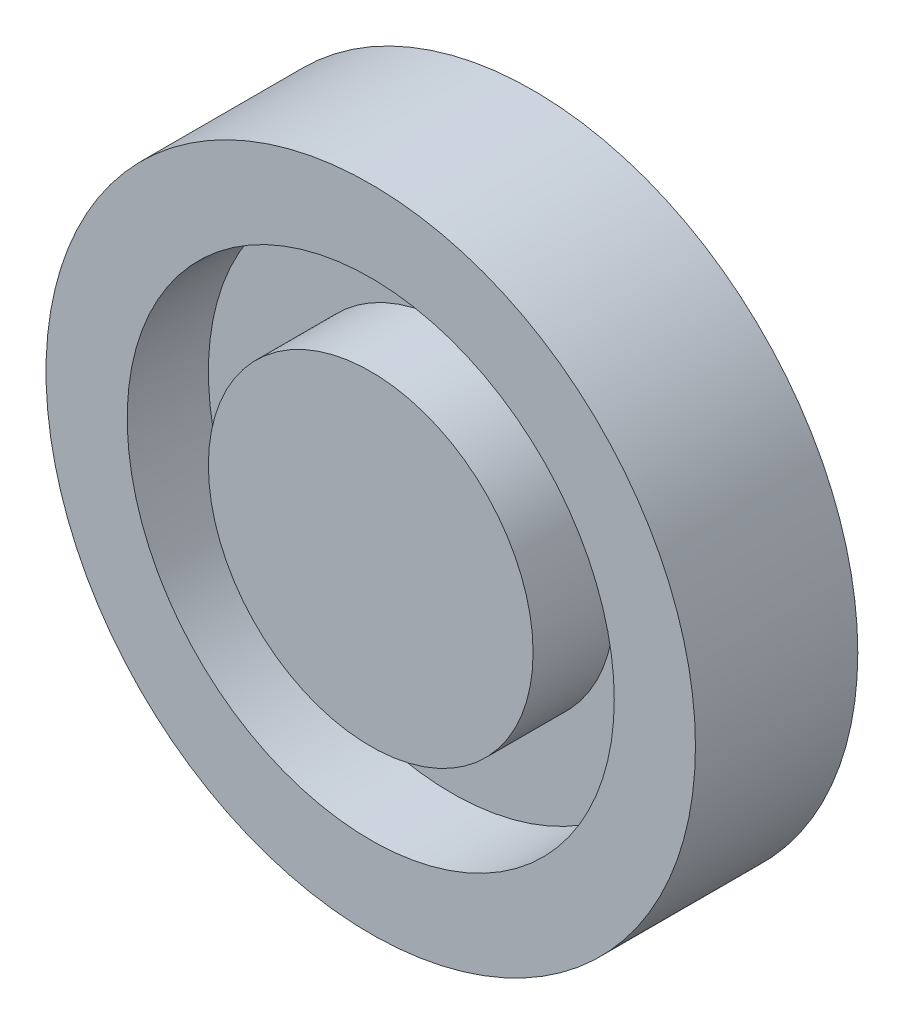
from build123d import *

# Parameters (mm, degrees)
SKETCH1_R           = 2
BOSS_EXTRUDE1_DEPTH = 1
SKETCH2_R           = 1.5
SKETCH2_R_2         = 1
CUT_EXTRUDE2_DEPTH  = 0.5


with BuildPart() as part:
    # Sketch1 → Boss-Extrude1 (new body)
    with BuildSketch(Plane.XY):
        Circle(SKETCH1_R)
    extrude(amount=BOSS_EXTRUDE1_DEPTH)

    # Sketch2 → Cut-Extrude2 (cut)
    with BuildSketch(Plane.XY.offset(1)):
        Circle(SKETCH2_R)
        Circle(SKETCH2_R_2, mode=Mode.SUBTRACT)
    extrude(amount=-CUT_EXTRUDE2_DEPTH, mode=Mode.SUBTRACT)


solid = part.part
